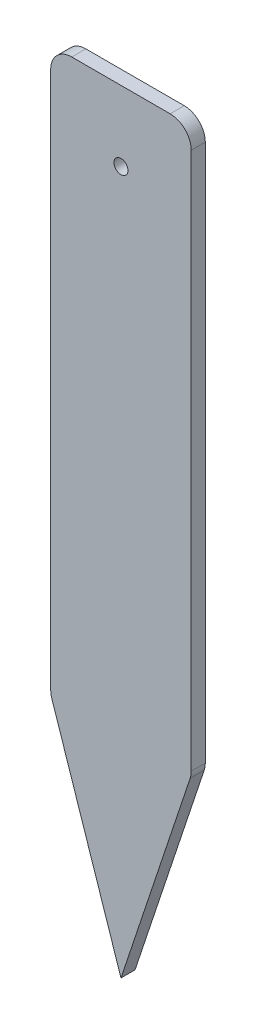
from build123d import *

# Parameters (mm, degrees)
SKETCH1_R           = 1
BOSS_EXTRUDE1_DEPTH = 2


with BuildPart() as part:
    # Sketch1 → Boss-Extrude1 (new body)
    with BuildSketch(Plane.XY):
        with BuildLine():
            Line((0, 0), (9.846049894, 29.538149682))
            ThreePointArc((9.846049894, 29.538149682), (9.961262373, 30.006286251), (10, 30.486832981))
            Line((10, 30.486832981), (10, 107))
            ThreePointArc((10, 107), (9.121320344, 109.121320344), (7, 110))
            Line((7, 110), (-7, 110))
            ThreePointArc((-7, 110), (-9.121320344, 109.121320344), (-10, 107))
            Line((-10, 107), (-10, 30.486832981))
            ThreePointArc((-10, 30.486832981), (-9.961262373, 30.006286251), (-9.846049894, 29.538149682))
            Line((-9.846049894, 29.538149682), (0, 0))
        make_face()
        with Locations((0, 100)):
            Circle(SKETCH1_R, mode=Mode.SUBTRACT)
    extrude(amount=BOSS_EXTRUDE1_DEPTH)


solid = part.part
